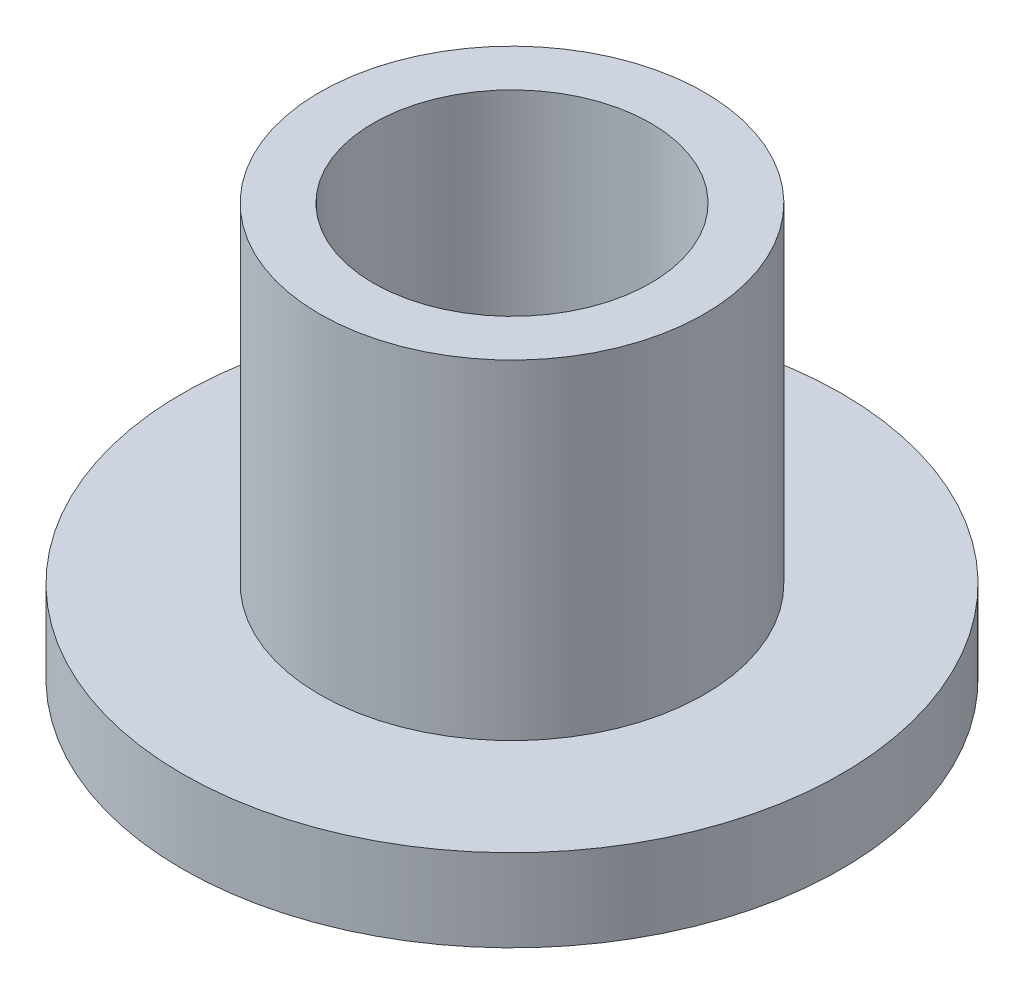
from build123d import *

# Parameters (mm, degrees)
ESBO_O1_R                = 12
RESSALTO_EXTRUS_O1_DEPTH = 3
ESBO_O2_R                = 7
RESSALTO_EXTRUS_O2_DEPTH = 12
ESBO_O3_R                = 5.05
CORTE_EXTRUS_O1_DEPTH    = 23.649503306


with BuildPart() as part:
    # Esboço1 → Ressalto-extrusão1 (new body)
    with BuildSketch(Plane(origin=(0, 0, 0), x_dir=(1, 0, 0), z_dir=(0, 1, 0))):
        with Locations(Location((0, 0, 0), (0, 0, 270))):
            Circle(ESBO_O1_R)
    extrude(amount=RESSALTO_EXTRUS_O1_DEPTH)

    # Esboço2 → Ressalto-extrusão2 (add)
    with BuildSketch(Plane(origin=(0, 3, 0), x_dir=(1, 0, 0), z_dir=(0, 1, 0))):
        with Locations(Location((0, 0, 0), (0, 0, 270))):
            Circle(ESBO_O2_R)
    extrude(amount=RESSALTO_EXTRUS_O2_DEPTH)

    # Esboço3 → Corte-extrusão1 (cut, through all)
    with BuildSketch(Plane(origin=(0, 15, 0), x_dir=(1, 0, 0), z_dir=(0, 1, 0))):
        with Locations(Location((0, 0, 0), (0, 0, 270))):
            Circle(ESBO_O3_R)
    extrude(amount=-CORTE_EXTRUS_O1_DEPTH, mode=Mode.SUBTRACT)


solid = part.part
